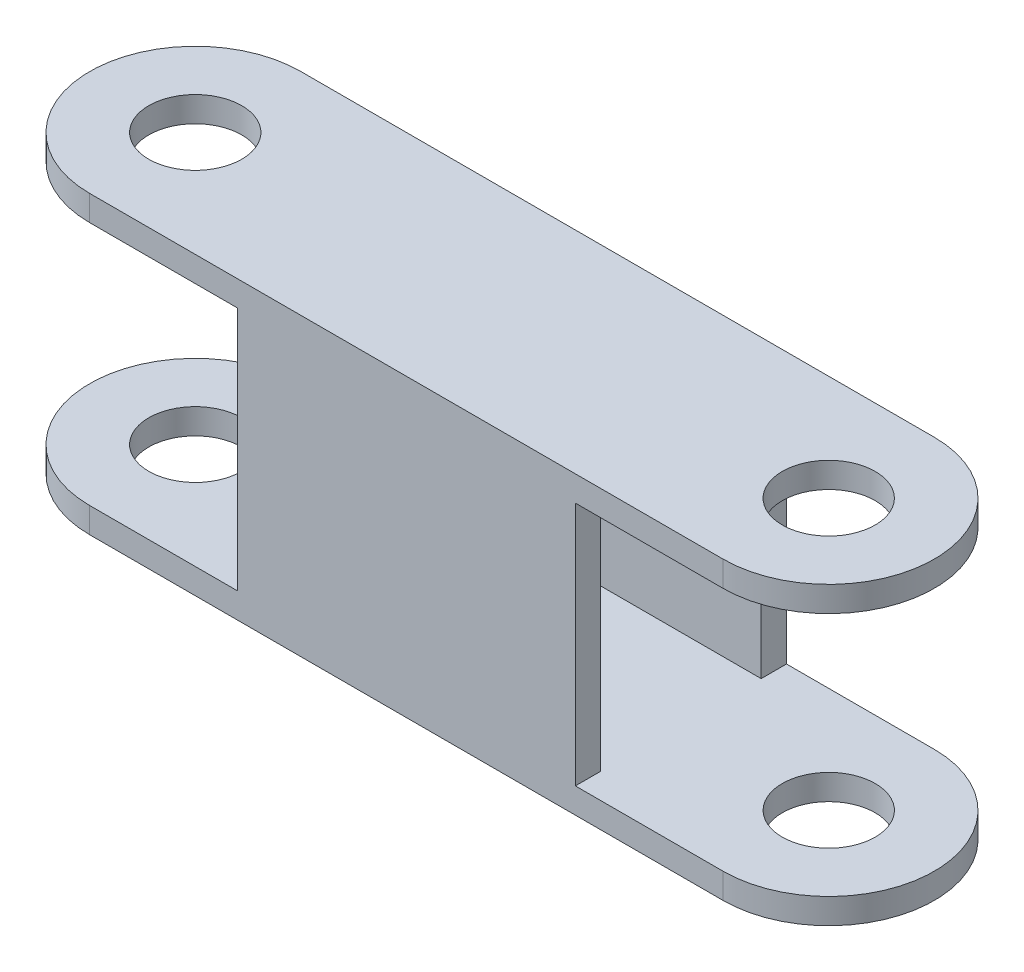
from build123d import *

# Parameters (mm, degrees)
SKETCH1_R           = 11
BOSS_EXTRUDE1_DEPTH = 35
SKETCH2_W           = 60
SKETCH2_H           = 58
CUT_EXTRUDE1_DEPTH  = 109.857705285
CUT_EXTRUDE2_REACH  = 148.458
SKETCH3_W           = 38
SKETCH3_H           = 58


with BuildPart() as part:
    # Sketch1 → Boss-Extrude1 (new, symmetric)
    with BuildSketch(Plane(origin=(0, 0, 0), x_dir=(1, 0, 0), z_dir=(0, 1, 0))):
        with BuildLine():
            Line((-75, 25), (75, 25))
            ThreePointArc((75, 25), (100, 0), (75, -25))
            Line((75, -25), (-75, -25))
            ThreePointArc((-75, -25), (-100, 0), (-75, 25))
        make_face()
        with Locations(Location((75, 0, 0), (0, 0, 270))):
            Circle(SKETCH1_R, mode=Mode.SUBTRACT)
        with Locations(Location((-75, 0, 0), (0, 0, 270))):
            Circle(SKETCH1_R, mode=Mode.SUBTRACT)
    extrude(amount=BOSS_EXTRUDE1_DEPTH, both=True)

    # Sketch2 → Cut-Extrude1 (cut, symmetric)
    with BuildSketch(Plane.XY):
        with Locations((70, 0)):
            Rectangle(SKETCH2_W, SKETCH2_H)
    cut_extrude1 = extrude(amount=CUT_EXTRUDE1_DEPTH, both=True, mode=Mode.SUBTRACT)

    # Mirror1: Cut-Extrude1 across plane
    add(cut_extrude1.mirror(Plane(origin=(0, 0, 0), x_dir=(0, 0, 1), z_dir=(1, 0, 0))), mode=Mode.SUBTRACT)

    # Sketch3 → Cut-Extrude2 (cut, up to next)
    with BuildSketch(Plane(origin=(40, 0, 0), x_dir=(0, 0, -1), z_dir=(1, 0, 0)), mode=Mode.PRIVATE) as cut_extrude2_sk1:
        Rectangle(SKETCH3_W, SKETCH3_H)
    cut_extrude2_tool1 = extrude(cut_extrude2_sk1.sketch, amount=-CUT_EXTRUDE2_REACH, mode=Mode.PRIVATE) & part.part
    add(cut_extrude2_tool1.solids().sort_by_distance((40, 0, 0))[0], mode=Mode.SUBTRACT)


solid = part.part
